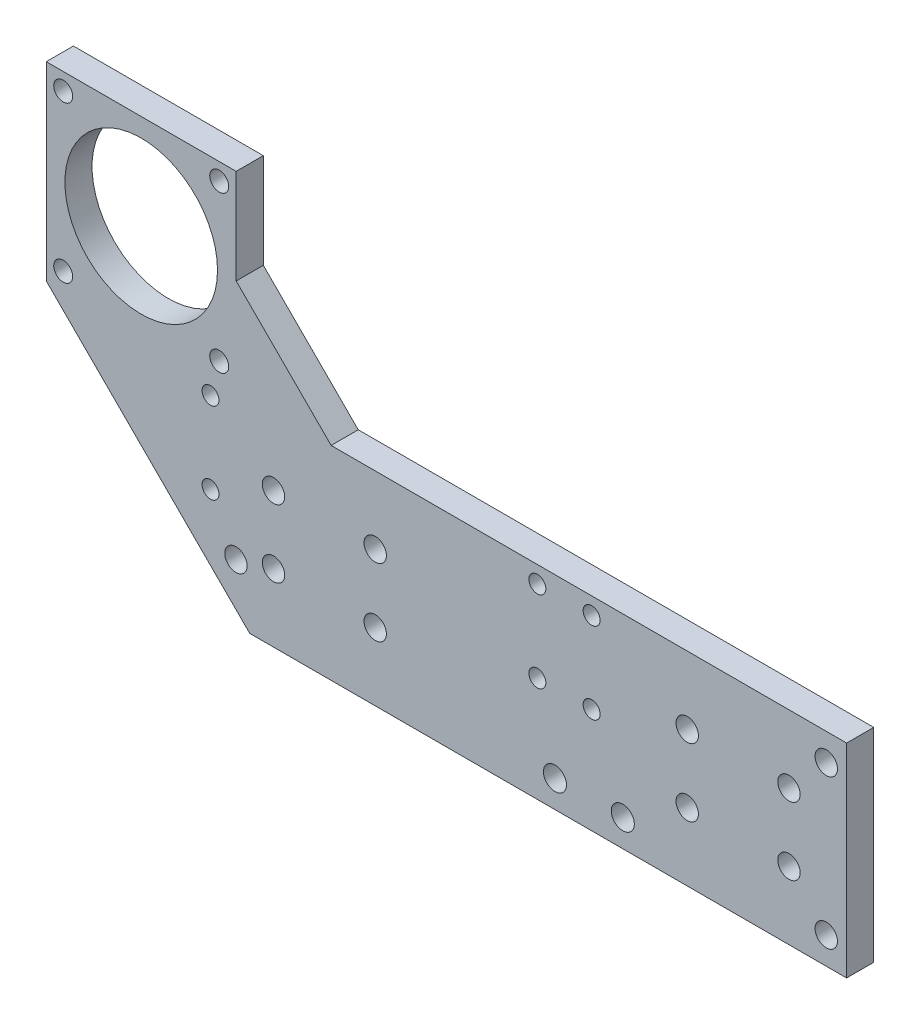
from build123d import *

# Parameters (mm, degrees)
SKETCH_1_W          = 112
SKETCH_1_H          = 58
EXTRUDE_1_DEPTH     = 4
SKETCH_2_OUTSIDE_W  = 139.238
SKETCH_2_OUTSIDE_H  = 85.238
CUT_EXTRUDE_1_DEPTH = 4
SKETCH_3_R          = 11.25
CUT_EXTRUDE_2_DEPTH = 4
CUT_EXTRUDE_3_REACH = 65.19
SKETCH_4_R          = 1.65
SKETCH_4_R_2        = 1.7
CUT_EXTRUDE_4_REACH = 65.19
SKETCH_5_R          = 1.25
SKETCH_8_W          = 6
SKETCH_8_H          = 30
EXTRUDE_3_DEPTH     = 4
CUT_EXTRUDE_5_REACH = 70.564
SKETCH_10_R         = 1.65
CUT_EXTRUDE_6_REACH = 70.564
SKETCH_11_R         = 1.65
SKETCH_13_R         = 1.4
CUT_EXTRUDE_7_DEPTH = 69.563838866


with BuildPart() as part:
    # 草图1 → 凸台-拉伸1 (new body)
    with BuildSketch(Plane.XY):
        Rectangle(SKETCH_1_W, SKETCH_1_H)
    extrude(amount=EXTRUDE_1_DEPTH)

    # 草图2 outside → 切除-拉伸1 (cut)
    with BuildSketch(Plane.XY.offset(4)):
        Rectangle(SKETCH_2_OUTSIDE_W, SKETCH_2_OUTSIDE_H)
        Polygon((56, 1), (-14, 1), (-28, 15), (-28, 29), (-56, 29), (-56, 1), (-26, -29), (56, -29), align=None, mode=Mode.SUBTRACT)
    extrude(amount=-CUT_EXTRUDE_1_DEPTH, mode=Mode.SUBTRACT)

    # 草图3 → 切除-拉伸2 (cut)
    with BuildSketch(Plane.XY.offset(4)):
        with Locations((-42, 15)):
            Circle(SKETCH_3_R)
    extrude(amount=-CUT_EXTRUDE_2_DEPTH, mode=Mode.SUBTRACT)

    # 草图4 → 切除-拉伸3 (cut, up to next)
    with BuildSketch(Plane.XY.offset(4), mode=Mode.PRIVATE) as cut_extrude_3_sk1:
        with Locations((-22.5, -19)):
            Circle(SKETCH_4_R)
    cut_extrude_3_tool1 = extrude(cut_extrude_3_sk1.sketch, amount=-CUT_EXTRUDE_3_REACH, mode=Mode.PRIVATE) & part.part
    # 草图4 → 切除-拉伸3 (cut, up to next)
    with BuildSketch(Plane.XY.offset(4), mode=Mode.PRIVATE) as cut_extrude_3_sk2:
        with Locations((-22.5, -9)):
            Circle(SKETCH_4_R)
    cut_extrude_3_tool2 = extrude(cut_extrude_3_sk2.sketch, amount=-CUT_EXTRUDE_3_REACH, mode=Mode.PRIVATE) & part.part
    # 草图4 → 切除-拉伸3 (cut, up to next)
    with BuildSketch(Plane.XY.offset(4), mode=Mode.PRIVATE) as cut_extrude_3_sk3:
        with Locations((-7.5, -19)):
            Circle(SKETCH_4_R)
    cut_extrude_3_tool3 = extrude(cut_extrude_3_sk3.sketch, amount=-CUT_EXTRUDE_3_REACH, mode=Mode.PRIVATE) & part.part
    # 草图4 → 切除-拉伸3 (cut, up to next)
    with BuildSketch(Plane.XY.offset(4), mode=Mode.PRIVATE) as cut_extrude_3_sk4:
        with Locations((-7.5, -9)):
            Circle(SKETCH_4_R)
    cut_extrude_3_tool4 = extrude(cut_extrude_3_sk4.sketch, amount=-CUT_EXTRUDE_3_REACH, mode=Mode.PRIVATE) & part.part
    # 草图4 → 切除-拉伸3 (cut, up to next)
    with BuildSketch(Plane.XY.offset(4), mode=Mode.PRIVATE) as cut_extrude_3_sk5:
        with Locations((38.5, -19)):
            Circle(SKETCH_4_R)
    cut_extrude_3_tool5 = extrude(cut_extrude_3_sk5.sketch, amount=-CUT_EXTRUDE_3_REACH, mode=Mode.PRIVATE) & part.part
    # 草图4 → 切除-拉伸3 (cut, up to next)
    with BuildSketch(Plane.XY.offset(4), mode=Mode.PRIVATE) as cut_extrude_3_sk6:
        with Locations((38.5, -9)):
            Circle(SKETCH_4_R)
    cut_extrude_3_tool6 = extrude(cut_extrude_3_sk6.sketch, amount=-CUT_EXTRUDE_3_REACH, mode=Mode.PRIVATE) & part.part
    # 草图4 → 切除-拉伸3 (cut, up to next)
    with BuildSketch(Plane.XY.offset(4), mode=Mode.PRIVATE) as cut_extrude_3_sk7:
        with Locations((53.5, -19)):
            Circle(SKETCH_4_R)
    cut_extrude_3_tool7 = extrude(cut_extrude_3_sk7.sketch, amount=-CUT_EXTRUDE_3_REACH, mode=Mode.PRIVATE) & part.part
    # 草图4 → 切除-拉伸3 (cut, up to next)
    with BuildSketch(Plane.XY.offset(4), mode=Mode.PRIVATE) as cut_extrude_3_sk8:
        with Locations((53.5, -9)):
            Circle(SKETCH_4_R)
    cut_extrude_3_tool8 = extrude(cut_extrude_3_sk8.sketch, amount=-CUT_EXTRUDE_3_REACH, mode=Mode.PRIVATE) & part.part
    # 草图4 → 切除-拉伸3 (cut, up to next)
    with BuildSketch(Plane.XY.offset(4), mode=Mode.PRIVATE) as cut_extrude_3_sk9:
        with Locations((19, -25)):
            Circle(SKETCH_4_R_2)
    cut_extrude_3_tool9 = extrude(cut_extrude_3_sk9.sketch, amount=-CUT_EXTRUDE_3_REACH, mode=Mode.PRIVATE) & part.part
    # 草图4 → 切除-拉伸3 (cut, up to next)
    with BuildSketch(Plane.XY.offset(4), mode=Mode.PRIVATE) as cut_extrude_3_sk10:
        with Locations((29, -25)):
            Circle(SKETCH_4_R_2)
    cut_extrude_3_tool10 = extrude(cut_extrude_3_sk10.sketch, amount=-CUT_EXTRUDE_3_REACH, mode=Mode.PRIVATE) & part.part
    add(cut_extrude_3_tool1.solids().sort_by_distance((-22.5, -19, 4))[0], mode=Mode.SUBTRACT)
    add(cut_extrude_3_tool2.solids().sort_by_distance((-22.5, -9, 4))[0], mode=Mode.SUBTRACT)
    add(cut_extrude_3_tool3.solids().sort_by_distance((-7.5, -19, 4))[0], mode=Mode.SUBTRACT)
    add(cut_extrude_3_tool4.solids().sort_by_distance((-7.5, -9, 4))[0], mode=Mode.SUBTRACT)
    add(cut_extrude_3_tool5.solids().sort_by_distance((38.5, -19, 4))[0], mode=Mode.SUBTRACT)
    add(cut_extrude_3_tool6.solids().sort_by_distance((38.5, -9, 4))[0], mode=Mode.SUBTRACT)
    add(cut_extrude_3_tool7.solids().sort_by_distance((53.5, -19, 4))[0], mode=Mode.SUBTRACT)
    add(cut_extrude_3_tool8.solids().sort_by_distance((53.5, -9, 4))[0], mode=Mode.SUBTRACT)
    add(cut_extrude_3_tool9.solids().sort_by_distance((19, -25, 4))[0], mode=Mode.SUBTRACT)
    add(cut_extrude_3_tool10.solids().sort_by_distance((29, -25, 4))[0], mode=Mode.SUBTRACT)

    # 草图5 → 切除-拉伸4 (cut, up to next)
    with BuildSketch(Plane(origin=(0, 0, 0), x_dir=(-1, 0, 0), z_dir=(0, 0, -1)), mode=Mode.PRIVATE) as cut_extrude_4_sk1:
        with Locations((-16.406007896, -13.5)):
            Circle(SKETCH_5_R)
    cut_extrude_4_tool1 = extrude(cut_extrude_4_sk1.sketch, amount=-CUT_EXTRUDE_4_REACH, mode=Mode.PRIVATE) & part.part
    # 草图5 → 切除-拉伸4 (cut, up to next)
    with BuildSketch(Plane(origin=(0, 0, 0), x_dir=(-1, 0, 0), z_dir=(0, 0, -1)), mode=Mode.PRIVATE) as cut_extrude_4_sk2:
        with Locations((-24.406007896, -13.5)):
            Circle(SKETCH_5_R)
    cut_extrude_4_tool2 = extrude(cut_extrude_4_sk2.sketch, amount=-CUT_EXTRUDE_4_REACH, mode=Mode.PRIVATE) & part.part
    # 草图5 → 切除-拉伸4 (cut, up to next)
    with BuildSketch(Plane(origin=(0, 0, 0), x_dir=(-1, 0, 0), z_dir=(0, 0, -1)), mode=Mode.PRIVATE) as cut_extrude_4_sk3:
        with Locations((-16.406007896, -1.5)):
            Circle(SKETCH_5_R)
    cut_extrude_4_tool3 = extrude(cut_extrude_4_sk3.sketch, amount=-CUT_EXTRUDE_4_REACH, mode=Mode.PRIVATE) & part.part
    # 草图5 → 切除-拉伸4 (cut, up to next)
    with BuildSketch(Plane(origin=(0, 0, 0), x_dir=(-1, 0, 0), z_dir=(0, 0, -1)), mode=Mode.PRIVATE) as cut_extrude_4_sk4:
        with Locations((-24.406007896, -1.5)):
            Circle(SKETCH_5_R)
    cut_extrude_4_tool4 = extrude(cut_extrude_4_sk4.sketch, amount=-CUT_EXTRUDE_4_REACH, mode=Mode.PRIVATE) & part.part
    # 草图5 → 切除-拉伸4 (cut, up to next)
    with BuildSketch(Plane(origin=(0, 0, 0), x_dir=(-1, 0, 0), z_dir=(0, 0, -1)), mode=Mode.PRIVATE) as cut_extrude_4_sk5:
        with Locations((31.779946847, -13.5)):
            Circle(SKETCH_5_R)
    cut_extrude_4_tool5 = extrude(cut_extrude_4_sk5.sketch, amount=-CUT_EXTRUDE_4_REACH, mode=Mode.PRIVATE) & part.part
    # 草图5 → 切除-拉伸4 (cut, up to next)
    with BuildSketch(Plane(origin=(0, 0, 0), x_dir=(-1, 0, 0), z_dir=(0, 0, -1)), mode=Mode.PRIVATE) as cut_extrude_4_sk6:
        with Locations((31.779946847, -1.5)):
            Circle(SKETCH_5_R)
    cut_extrude_4_tool6 = extrude(cut_extrude_4_sk6.sketch, amount=-CUT_EXTRUDE_4_REACH, mode=Mode.PRIVATE) & part.part
    add(cut_extrude_4_tool1.solids().sort_by_distance((16.406008, -13.5, 0))[0], mode=Mode.SUBTRACT)
    add(cut_extrude_4_tool2.solids().sort_by_distance((24.406008, -13.5, 0))[0], mode=Mode.SUBTRACT)
    add(cut_extrude_4_tool3.solids().sort_by_distance((16.406008, -1.5, 0))[0], mode=Mode.SUBTRACT)
    add(cut_extrude_4_tool4.solids().sort_by_distance((24.406008, -1.5, 0))[0], mode=Mode.SUBTRACT)
    add(cut_extrude_4_tool5.solids().sort_by_distance((-31.779947, -13.5, 0))[0], mode=Mode.SUBTRACT)
    add(cut_extrude_4_tool6.solids().sort_by_distance((-31.779947, -1.5, 0))[0], mode=Mode.SUBTRACT)

    # 草图8 → 凸台-拉伸3 (add)
    with BuildSketch(Plane(origin=(0, 0, 0), x_dir=(-1, 0, 0), z_dir=(0, 0, -1))):
        with Locations((-59, -14)):
            Rectangle(SKETCH_8_W, SKETCH_8_H)
    extrude(amount=-EXTRUDE_3_DEPTH)

    # 草图10 → 切除-拉伸5 (cut, up to next)
    with BuildSketch(Plane.XY.offset(4), mode=Mode.PRIVATE) as cut_extrude_5_sk1:
        with Locations((59, -25)):
            Circle(SKETCH_10_R)
    cut_extrude_5_tool1 = extrude(cut_extrude_5_sk1.sketch, amount=-CUT_EXTRUDE_5_REACH, mode=Mode.PRIVATE) & part.part
    # 草图10 → 切除-拉伸5 (cut, up to next)
    with BuildSketch(Plane.XY.offset(4), mode=Mode.PRIVATE) as cut_extrude_5_sk2:
        with Locations((59, -3)):
            Circle(SKETCH_10_R)
    cut_extrude_5_tool2 = extrude(cut_extrude_5_sk2.sketch, amount=-CUT_EXTRUDE_5_REACH, mode=Mode.PRIVATE) & part.part
    add(cut_extrude_5_tool1.solids().sort_by_distance((59, -25, 4))[0], mode=Mode.SUBTRACT)
    add(cut_extrude_5_tool2.solids().sort_by_distance((59, -3, 4))[0], mode=Mode.SUBTRACT)

    # 草图11 → 切除-拉伸6 (cut, up to next)
    with BuildSketch(Plane.XY.offset(4), mode=Mode.PRIVATE) as cut_extrude_6_sk1:
        with Locations((-28.036589911, -20.593670707)):
            Circle(SKETCH_11_R)
    cut_extrude_6_tool1 = extrude(cut_extrude_6_sk1.sketch, amount=-CUT_EXTRUDE_6_REACH, mode=Mode.PRIVATE) & part.part
    add(cut_extrude_6_tool1.solids().sort_by_distance((-28.03659, -20.593671, 4))[0], mode=Mode.SUBTRACT)

    # 草图13 → 切除-拉伸7 (cut, through all)
    with BuildSketch(Plane(origin=(0, 0, 0), x_dir=(-1, 0, 0), z_dir=(0, 0, -1))):
        with Locations((53.5, 26.5)):
            Circle(SKETCH_13_R)
        with Locations((53.5, 3.5)):
            Circle(SKETCH_13_R)
        with Locations((30.5, 3.5)):
            Circle(SKETCH_13_R)
        with Locations((30.5, 26.5)):
            Circle(SKETCH_13_R)
    extrude(amount=-CUT_EXTRUDE_7_DEPTH, mode=Mode.SUBTRACT)


solid = part.part
